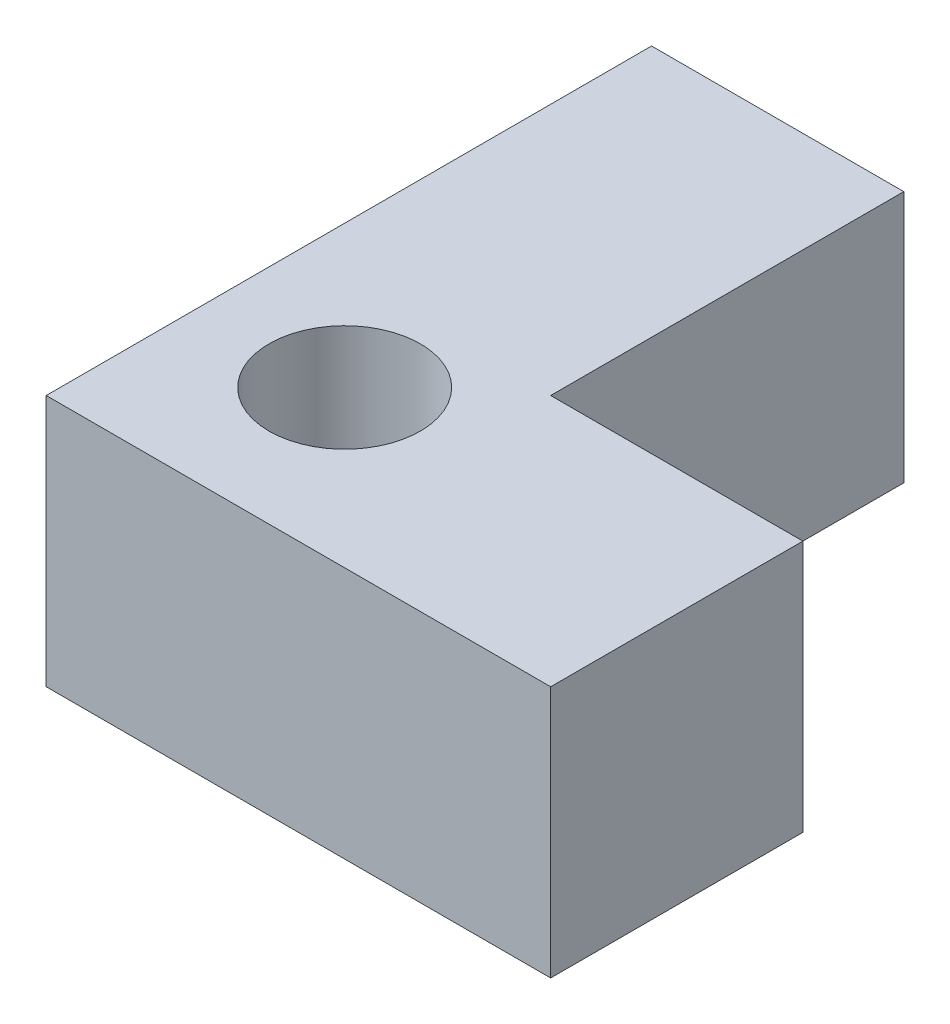
from build123d import *

# Parameters (mm, degrees)
BOSS_EXTRUDE1_DEPTH = 12.7
SKETCH2_R           = 3.81
CUT_EXTRUDE1_DEPTH  = 47.766419161


with BuildPart() as part:
    # Sketch1 → Boss-Extrude1 (new body)
    with BuildSketch(Plane(origin=(0, 0, 0), x_dir=(1, 0, 0), z_dir=(0, 1, 0))):
        Polygon((-38.914531528, 22.615640542), (-38.914531528, -7.864359458), (-13.514531528, -7.864359458), (-13.514531528, 4.835640542), (-26.214531528, 4.835640542), (-26.214531528, 22.615640542), align=None)
    extrude(amount=BOSS_EXTRUDE1_DEPTH)

    # Sketch2 → Cut-Extrude1 (cut, through all)
    with BuildSketch(Plane(origin=(0, 12.7, 0), x_dir=(1, 0, 0), z_dir=(0, 1, 0))):
        with Locations(Location((-31.75, 0, 0), (0, 0, 270))):
            Circle(SKETCH2_R)
    extrude(amount=-CUT_EXTRUDE1_DEPTH, mode=Mode.SUBTRACT)


solid = part.part
